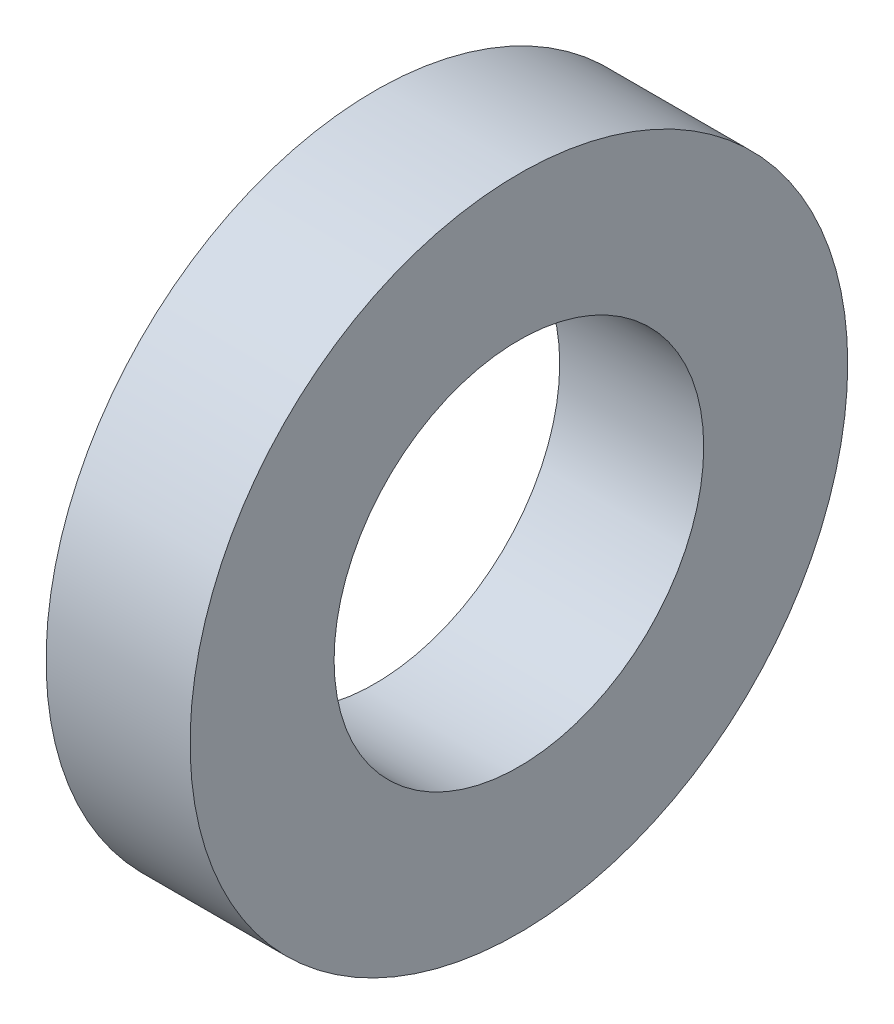
from build123d import *

# Parameters (mm, degrees)
SKETCH1_R           = 14.5
SKETCH1_R_2         = 8.15
BOSS_EXTRUDE1_DEPTH = 6.35


with BuildPart() as part:
    # Sketch1 → Boss-Extrude1 (new body)
    with BuildSketch(Plane(origin=(0, 0, 0), x_dir=(0, 0, -1), z_dir=(1, 0, 0))):
        Circle(SKETCH1_R)
        Circle(SKETCH1_R_2, mode=Mode.SUBTRACT)
    extrude(amount=BOSS_EXTRUDE1_DEPTH)


solid = part.part
